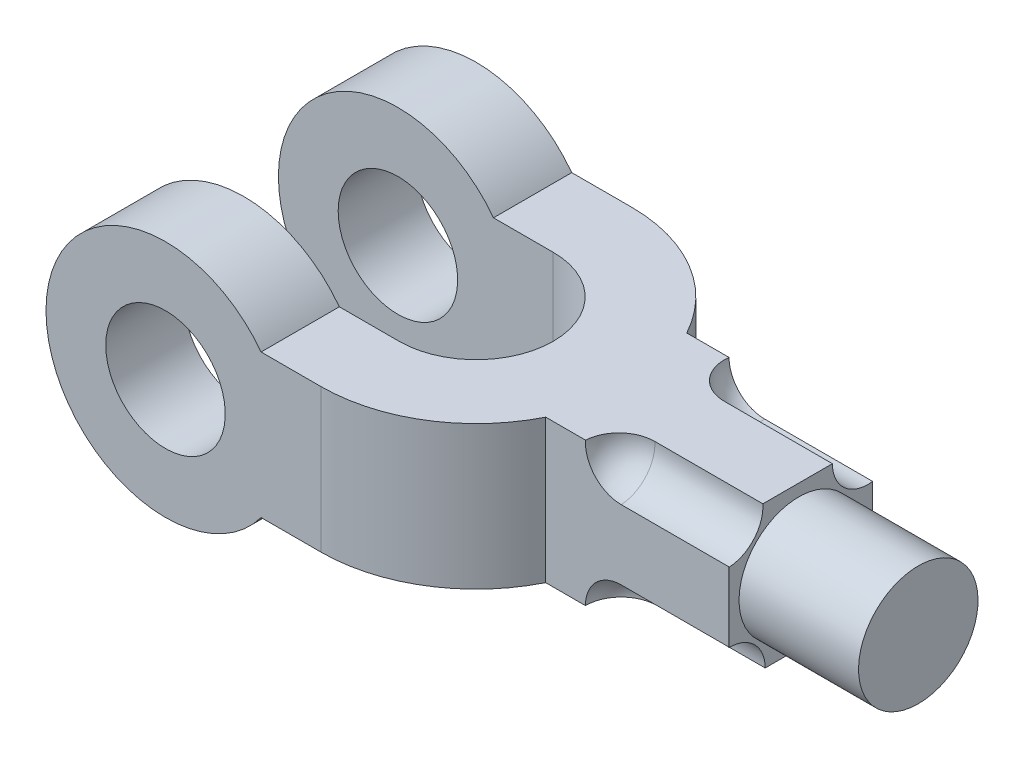
from build123d import *

# Parameters (mm, degrees)
SKETCH1_W           = 20
SKETCH1_H           = 10
SKETCH1_8_R         = 10
BOSS_EXTRUDE4_DEPTH = 26
CUT_EXTRUDE2_DEPTH  = 26
SKETCH5_W           = 14.33272529
SKETCH5_H           = 24
CUT_EXTRUDE3_DEPTH  = 10
SKETCH7_R           = 6
CUT_EXTRUDE4_DEPTH  = 10
CIRPATTERN2_COUNT   = 4
CIRPATTERN3_COUNT   = 4


with BuildPart() as part:
    # Sketch1 → Revolve1 (revolve)
    with BuildSketch(Plane.XY):
        with Locations((90, 5)):
            Rectangle(SKETCH1_W, SKETCH1_H)
    revolve(axis=Axis((80, 0, 0), (1, 0, 0)))

    # Sketch1<8> → Boss-Extrude4 (add, symmetric)
    with BuildSketch(Plane.XY):
        with BuildLine():
            ThreePointArc((16, 12), (-20, 0), (16, -12))
            Line((16, -12), (80, -12))
            Line((80, -12), (80, 12))
            Line((80, 12), (16, 12))
        make_face()
        Circle(SKETCH1_8_R, mode=Mode.SUBTRACT)
    extrude(amount=BOSS_EXTRUDE4_DEPTH, both=True)

    # Sketch4 → Cut-Extrude2 (cut, symmetric)
    with BuildSketch(Plane(origin=(0, 0, 0), x_dir=(1, 0, 0), z_dir=(0, 1, 0))):
        with BuildLine():
            Line((48.864488658, 12.378011085), (80, 12.378011085))
            Line((80, 12.378011085), (80, 26))
            Line((80, 26), (26, 26))
            ThreePointArc((26, 26), (39.307360966, 22.336386102), (48.864488658, 12.378011085))
        make_face()
        with BuildLine():
            Line((26, -26), (80, -26))
            Line((80, -26), (79.906653098, -11.621988915))
            Line((79.906653098, -11.621988915), (49.257888418, -11.621988915))
            ThreePointArc((49.257888418, -11.621988915), (39.671654768, -22.115285571), (26, -26))
        make_face()
        with BuildLine():
            ThreePointArc((26, -12.901292498), (38.901292498, 0), (26, 12.901292498))
            Line((26, 12.901292498), (-20, 12.901292498))
            Line((-20, 12.901292498), (-20, -12.901292498))
            Line((-20, -12.901292498), (26, -12.901292498))
        make_face()
    extrude(amount=CUT_EXTRUDE2_DEPTH, both=True, mode=Mode.SUBTRACT)

    # Sketch5 → Cut-Extrude3 (cut)
    with BuildSketch(Plane(origin=(80, 0, 0), x_dir=(0, 0, -1), z_dir=(1, 0, 0))):
        with Locations((-18.833637355, 0)):
            Rectangle(SKETCH5_W, SKETCH5_H)
    extrude(amount=-CUT_EXTRUDE3_DEPTH, mode=Mode.SUBTRACT)

    # Sketch6 → Cut-Revolve3 (revolve, cut)
    with BuildSketch(Plane.XY.offset(11.621988915)):
        with BuildLine():
            Line((79.906653098, -12), (79.906653098, -6))
            Line((79.906653098, -6), (61.906653098, -6))
            ThreePointArc((61.906653098, -6), (57.664012411, -7.757359313), (55.906653098, -12))
            Line((55.906653098, -12), (79.906653098, -12))
        make_face()
    cut_revolve3 = revolve(axis=Axis((81.079011265, -12, 11.621988915), (-1, 0, 0)), mode=Mode.SUBTRACT)

    # Sketch7 → Cut-Extrude4 (cut)
    with BuildSketch(Plane.ZY.offset(-79.906653098)):
        with Locations((11.621988915, -12)):
            Circle(SKETCH7_R)
    cut_extrude4 = extrude(amount=-CUT_EXTRUDE4_DEPTH, mode=Mode.SUBTRACT)

    # CirPattern2: Cut-Revolve3 ×4 about axis
    cirpattern2_axis = Axis((81.079011265, -12, 11.621988915), (1, 0, 0))
    for i in range(1, CIRPATTERN2_COUNT):
        add(cut_revolve3.rotate(cirpattern2_axis, i * 360 / CIRPATTERN2_COUNT), mode=Mode.SUBTRACT)

    # CirPattern3: Cut-Revolve3, Cut-Extrude4 ×4 about axis
    cirpattern3_axis = Axis((100, 0, 0), (-1, 0, 0))
    add([cut_revolve3.rotate(cirpattern3_axis, i * 360 / CIRPATTERN3_COUNT) for i in range(1, CIRPATTERN3_COUNT)], mode=Mode.SUBTRACT)
    add([cut_extrude4.rotate(cirpattern3_axis, i * 360 / CIRPATTERN3_COUNT) for i in range(1, CIRPATTERN3_COUNT)], mode=Mode.SUBTRACT)


solid = part.part
